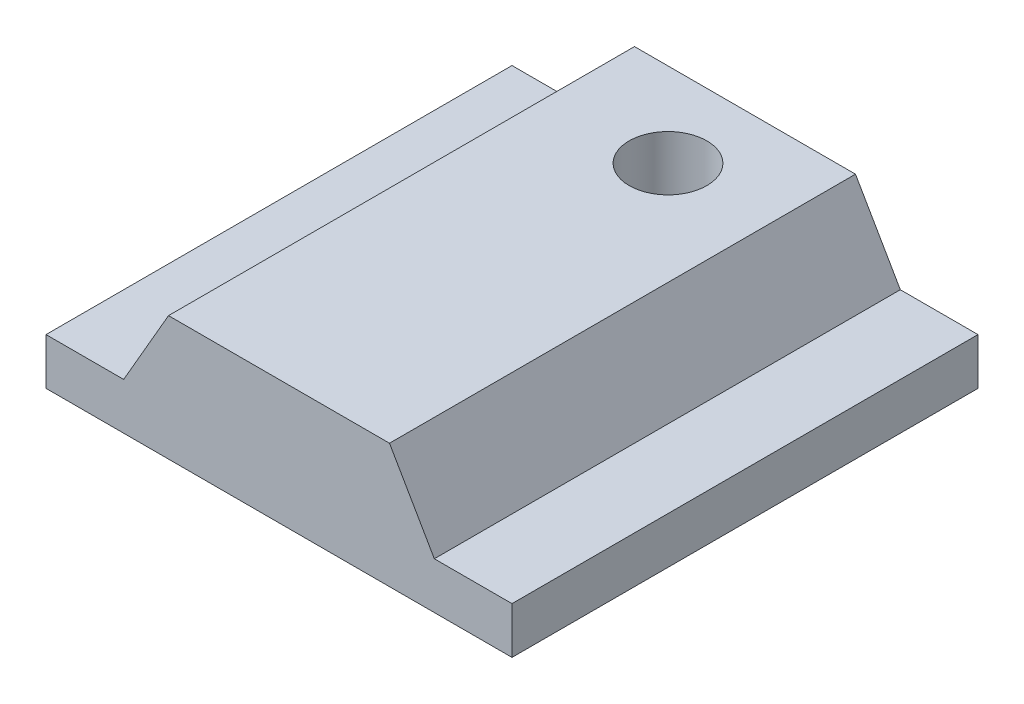
from build123d import *

# Parameters (mm, degrees)
SKETCH_1_W          = 30
SKETCH_1_H          = 8
EXTRUDE_1_DEPTH     = 30
CUT_EXTRUDE_2_DEPTH = 44.17406629
M6X1_01_D           = 5
M6X1_01_DEPTH       = 17
M6X1_01_TIP         = 1.502151548


with BuildPart() as part:
    # Эскиз1 → Бобышка-Вытянуть1 (new body)
    with BuildSketch(Plane.XY):
        with Locations((15, 4)):
            Rectangle(SKETCH_1_W, SKETCH_1_H)
    extrude(amount=EXTRUDE_1_DEPTH)

    # Эскиз3 → Вырез-Вытянуть2 (cut, through all)
    with BuildSketch(Plane.XY.offset(30)):
        Polygon((5, 3), (7.886751346, 8), (5, 8), (0, 8), (0, 3), align=None)
        Polygon((25, 3), (30, 3), (30, 8), (25, 8), (22.113248654, 8), align=None)
    extrude(amount=-CUT_EXTRUDE_2_DEPTH, mode=Mode.SUBTRACT)

    # Отверстие обработанное метчиком M6x1.01
    with Locations(Plane(origin=(0, 8, 0), x_dir=(1, 0, 0), z_dir=(0, 1, 0))):
        with Locations((15.468545431, -5.425177516)):
            Hole(M6X1_01_D / 2, depth=M6X1_01_DEPTH)
            with Locations((0, 0, -(M6X1_01_DEPTH + M6X1_01_TIP / 2))):  # 118° drill point
                Cone(0, M6X1_01_D / 2, M6X1_01_TIP, mode=Mode.SUBTRACT)


solid = part.part
